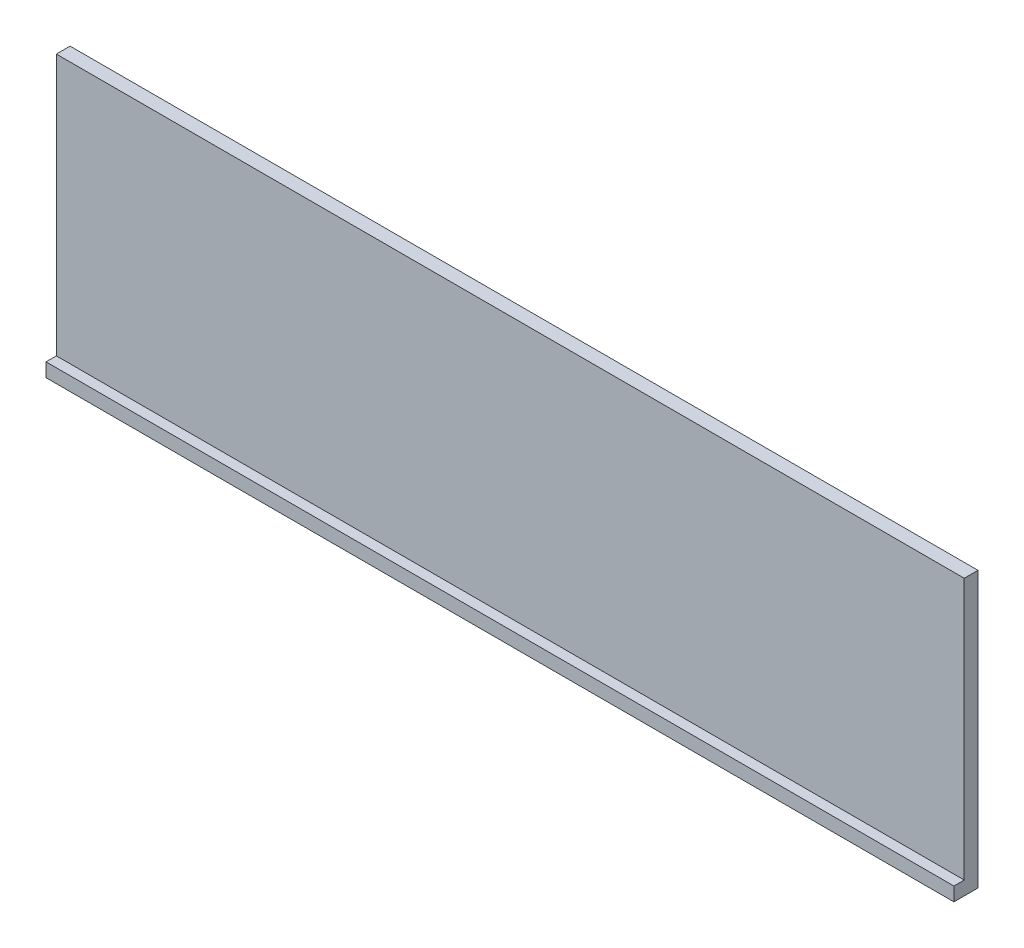
from build123d import *

# Parameters (mm, degrees)
SKETCH_1_W      = 132
SKETCH_1_H      = 40
EXTRUDE_1_DEPTH = 2
SKETCH_2_W      = 132
SKETCH_2_H      = 2
EXTRUDE_2_DEPTH = 1.5


with BuildPart() as part:
    # 草图1 → 凸台-拉伸1 (new body)
    with BuildSketch(Plane.XY):
        with Locations((36.073349633, 2.0599022)):
            Rectangle(SKETCH_1_W, SKETCH_1_H)
    extrude(amount=EXTRUDE_1_DEPTH)

    # 草图2 → 凸台-拉伸2 (add)
    with BuildSketch(Plane.XY.offset(2)):
        with Locations((36.073349633, -16.9400978)):
            Rectangle(SKETCH_2_W, SKETCH_2_H)
    extrude(amount=EXTRUDE_2_DEPTH)


solid = part.part
